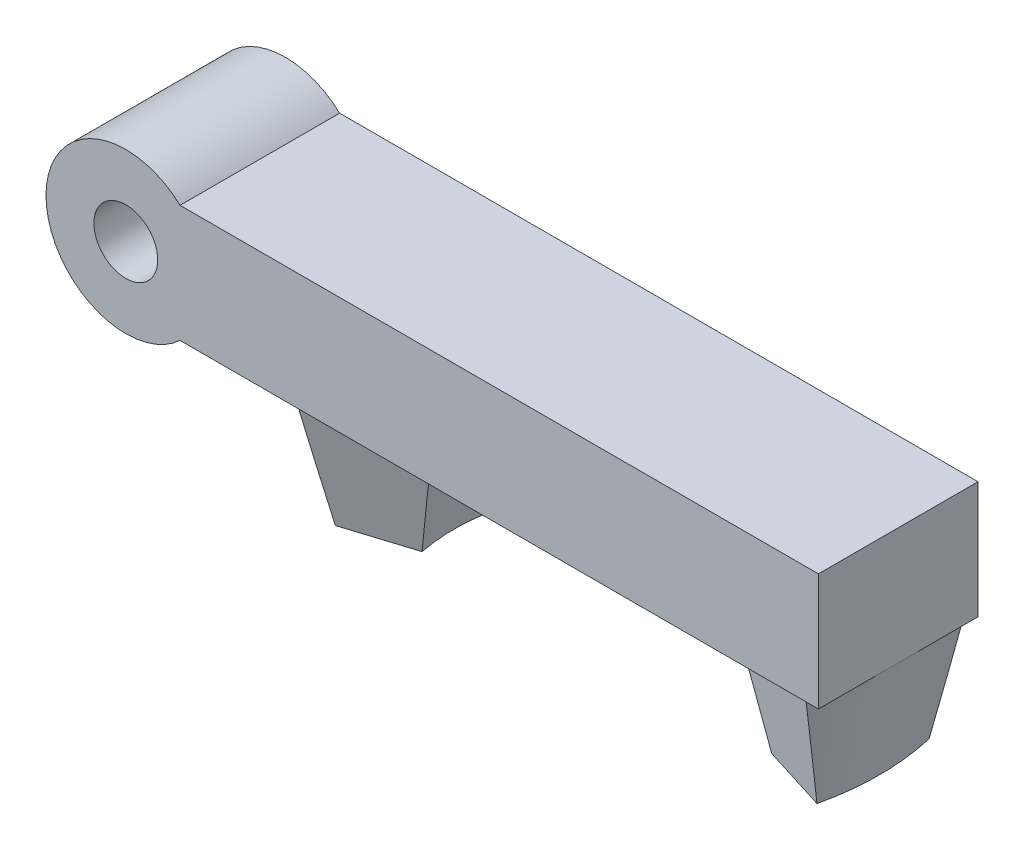
from build123d import *

# Parameters (mm, degrees)
SKETCH1_R                     = 1.5
BOSS_EXTRUDE1_DEPTH           = 7.5
BOSS_EXTRUDE3_DEPTH           = 5
BOSS_EXTRUDE3_DRAFT           = 10
BOSS_EXTRUDE3_PROFILE_2_DEPTH = 5
BOSS_EXTRUDE3_PROFILE_2_DRAFT = 10


with BuildPart() as part:
    # Sketch1 → Boss-Extrude1 (new body)
    with BuildSketch(Plane.XY):
        with BuildLine():
            Line((2.549509757, 2.75), (32.549509757, 2.75))
            Line((32.549509757, 2.75), (32.549509757, -2.75))
            Line((32.549509757, -2.75), (22.049509757, -2.75))
            Line((22.049509757, -2.75), (2.549509757, -2.75))
            ThreePointArc((2.549509757, -2.75), (-3.75, 0), (2.549509757, 2.75))
        make_face()
        Circle(SKETCH1_R, mode=Mode.SUBTRACT)
    extrude(amount=BOSS_EXTRUDE1_DEPTH)


with BuildPart() as boss_extrude3_tool:
    # Sketch2 → Boss-Extrude3 (with draft: the straight prism first)
    with BuildSketch(Plane.XZ.offset(2.75)):
        with BuildLine():
            Line((31.973749775, 7.5), (27.204053767, 6))
            ThreePointArc((27.204053767, 6), (27.549509757, 3.75), (27.204053767, 1.5))
            Line((27.204053767, 1.5), (31.973749775, 0))
            ThreePointArc((31.973749775, 0), (32.549509757, 3.75), (31.973749775, 7.5))
        make_face()
    extrude(amount=BOSS_EXTRUDE3_DEPTH)
    # Boss-Extrude3: the draft: its side faces are tilted about the plane it starts from
    boss_extrude3_sides = [boss_extrude3_tool.faces().sort_by_distance(p)[0] for p in [
        (32.549509757, -5.25, 3.75),
        (29.588901771, -5.25, 6.75),
        (27.549509757, -5.25, 3.75),
        (29.588901771, -5.25, 0.75),
    ]]
    draft(boss_extrude3_sides, Plane.XZ.offset(2.75), BOSS_EXTRUDE3_DRAFT)


with BuildPart() as part_1:
    add(part.part)

    # Boss-Extrude3: add boss_extrude3_tool
    add(boss_extrude3_tool.part)


with BuildPart() as boss_extrude3_profile_2_tool:
    # Sketch2 → Boss-Extrude3 profile 2 (with draft: the straight prism first)
    with BuildSketch(Plane.XZ.offset(2.75)):
        with BuildLine():
            ThreePointArc((8.125269739, 7.5), (7.549509757, 3.75), (8.125269739, 0))
            Line((8.125269739, 0), (12.894965746, 1.5))
            ThreePointArc((12.894965746, 1.5), (12.549509757, 3.75), (12.894965746, 6))
            Line((12.894965746, 6), (8.125269739, 7.5))
        make_face()
    extrude(amount=BOSS_EXTRUDE3_PROFILE_2_DEPTH)
    # Boss-Extrude3 profile 2: the draft: its side faces are tilted about the plane it starts from
    boss_extrude3_profile_2_sides = [boss_extrude3_profile_2_tool.faces().sort_by_distance(p)[0] for p in [
        (10.510117743, -5.25, 0.75),
        (12.549509757, -5.25, 3.75),
        (10.510117743, -5.25, 6.75),
        (7.549509757, -5.25, 3.75),
    ]]
    draft(boss_extrude3_profile_2_sides, Plane.XZ.offset(2.75), BOSS_EXTRUDE3_PROFILE_2_DRAFT)


with BuildPart() as part_2:
    add(part_1.part)

    # Boss-Extrude3 profile 2: add boss_extrude3_profile_2_tool
    add(boss_extrude3_profile_2_tool.part)


solid = part_2.part
